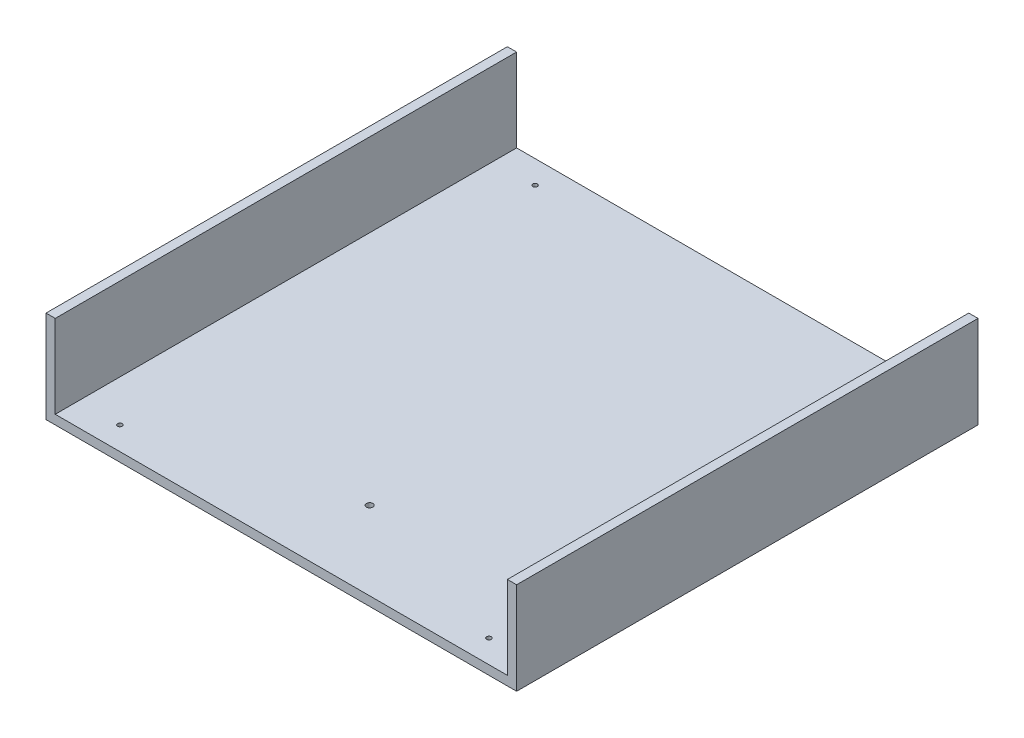
from build123d import *

# Parameters (mm, degrees)
CROQUIS2_W              = 51
CROQUIS2_H              = 50
SALIENTE_EXTRUIR3_DEPTH = 10
CROQUIS6_W              = 49
CROQUIS6_H              = 9
CORTAR_EXTRUIR4_DEPTH   = 50
CORTAR_EXTRUIR5_REACH   = 38.827
CROQUIS7_R              = 0.25
CORTAR_EXTRUIR7_REACH   = 38.827
CROQUIS10_R             = 0.25
CORTAR_EXTRUIR8_REACH   = 38.827
CROQUIS11_R             = 0.25
CORTAR_EXTRUIR9_REACH   = 38.827
CROQUIS12_R             = 0.25
CORTAR_EXTRUIR10_REACH  = 38.827
CROQUIS13_R             = 0.35


with BuildPart() as part:
    # Croquis2 → Saliente-Extruir3 (new body)
    with BuildSketch(Plane(origin=(0, 0, 0), x_dir=(1, 0, 0), z_dir=(0, 1, 0))):
        Rectangle(CROQUIS2_W, CROQUIS2_H)
    extrude(amount=SALIENTE_EXTRUIR3_DEPTH)

    # Croquis6 → Cortar-Extruir4 (cut)
    with BuildSketch(Plane.XY.offset(25)):
        with Locations((0, 5.5)):
            Rectangle(CROQUIS6_W, CROQUIS6_H)
    extrude(amount=-CORTAR_EXTRUIR4_DEPTH, mode=Mode.SUBTRACT)

    # Croquis7 → Cortar-Extruir5 (cut, up to next)
    with BuildSketch(Plane(origin=(0, 1, 0), x_dir=(1, 0, 0), z_dir=(0, 1, 0)), mode=Mode.PRIVATE) as cortar_extruir5_sk1:
        with Locations(Location((-20, 22.5, 0), (0, 0, 270))):
            Circle(CROQUIS7_R)
    cortar_extruir5_tool1 = extrude(cortar_extruir5_sk1.sketch, amount=-CORTAR_EXTRUIR5_REACH, mode=Mode.PRIVATE) & part.part
    add(cortar_extruir5_tool1.solids().sort_by_distance((-20, 1, -22.5))[0], mode=Mode.SUBTRACT)

    # Croquis10 → Cortar-Extruir7 (cut, up to next)
    with BuildSketch(Plane(origin=(0, 1, 0), x_dir=(1, 0, 0), z_dir=(0, 1, 0)), mode=Mode.PRIVATE) as cortar_extruir7_sk1:
        with Locations(Location((20, 22.5, 0), (0, 0, 270))):
            Circle(CROQUIS10_R)
    cortar_extruir7_tool1 = extrude(cortar_extruir7_sk1.sketch, amount=-CORTAR_EXTRUIR7_REACH, mode=Mode.PRIVATE) & part.part
    add(cortar_extruir7_tool1.solids().sort_by_distance((20, 1, -22.5))[0], mode=Mode.SUBTRACT)

    # Croquis11 → Cortar-Extruir8 (cut, up to next)
    with BuildSketch(Plane(origin=(0, 1, 0), x_dir=(1, 0, 0), z_dir=(0, 1, 0)), mode=Mode.PRIVATE) as cortar_extruir8_sk1:
        with Locations(Location((-20, -22.5, 0), (0, 0, 270))):
            Circle(CROQUIS11_R)
    cortar_extruir8_tool1 = extrude(cortar_extruir8_sk1.sketch, amount=-CORTAR_EXTRUIR8_REACH, mode=Mode.PRIVATE) & part.part
    add(cortar_extruir8_tool1.solids().sort_by_distance((-20, 1, 22.5))[0], mode=Mode.SUBTRACT)

    # Croquis12 → Cortar-Extruir9 (cut, up to next)
    with BuildSketch(Plane(origin=(0, 1, 0), x_dir=(1, 0, 0), z_dir=(0, 1, 0)), mode=Mode.PRIVATE) as cortar_extruir9_sk1:
        with Locations(Location((20, -22.5, 0), (0, 0, 270))):
            Circle(CROQUIS12_R)
    cortar_extruir9_tool1 = extrude(cortar_extruir9_sk1.sketch, amount=-CORTAR_EXTRUIR9_REACH, mode=Mode.PRIVATE) & part.part
    add(cortar_extruir9_tool1.solids().sort_by_distance((20, 1, 22.5))[0], mode=Mode.SUBTRACT)

    # Croquis13 → Cortar-Extruir10 (cut, up to next)
    with BuildSketch(Plane(origin=(0, 1, 0), x_dir=(1, 0, 0), z_dir=(0, 1, 0)), mode=Mode.PRIVATE) as cortar_extruir10_sk1:
        with Locations(Location((1.077350269, -16.5, 0), (0, 0, 270))):
            Circle(CROQUIS13_R)
    cortar_extruir10_tool1 = extrude(cortar_extruir10_sk1.sketch, amount=-CORTAR_EXTRUIR10_REACH, mode=Mode.PRIVATE) & part.part
    add(cortar_extruir10_tool1.solids().sort_by_distance((1.07735, 1, 16.5))[0], mode=Mode.SUBTRACT)


solid = part.part
